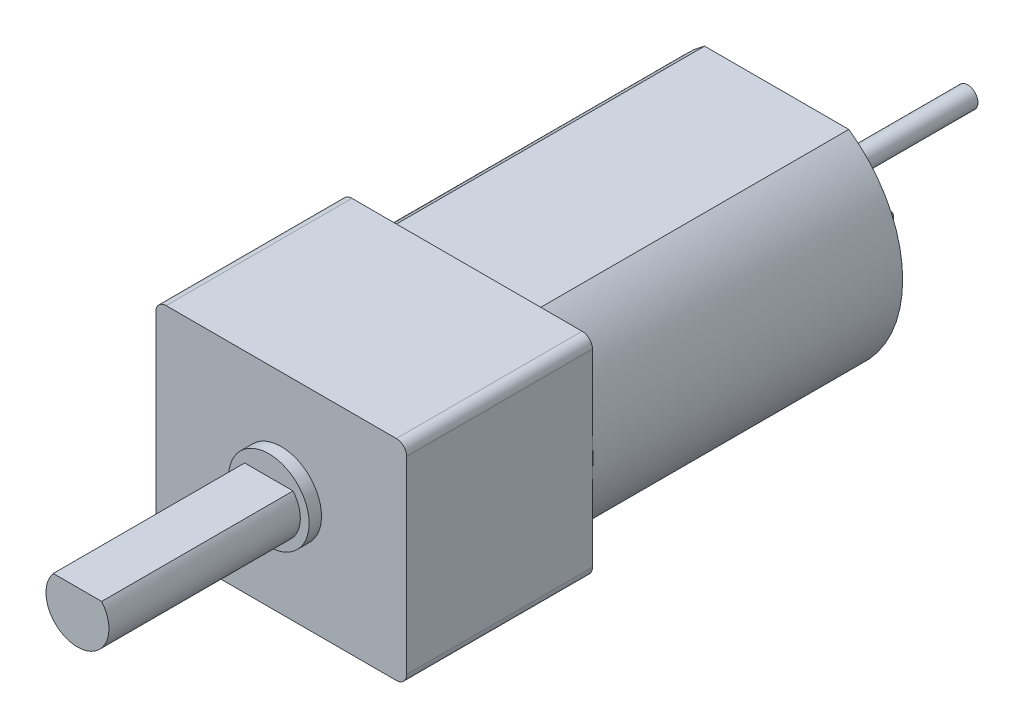
from build123d import *

# Parameters (mm, degrees)
SKETCH1_W            = 12.15
SKETCH1_H            = 10.15
EXTRUDE2_DEPTH       = 9
SKETCH11_R           = 1.95
EXTRUDE5_DEPTH       = 0.6
EXTRUDE6_DEPTH       = 9.27
EXTRUDE7_DEPTH       = 15
SKETCH14_R           = 2.5
EXTRUDE8_DEPTH       = 1.5
SKETCH16_W           = 0.3
SKETCH16_H           = 1.5
EXTRUDE10_DEPTH      = 2
FILLET1_R            = 0.3
FILLET1_OF_MIRROR1_R = 0.3
FILLET2_R            = 0.5
FILLET3_R            = 0.3
SKETCH17_R           = 0.5
EXTRUDE11_DEPTH      = 7.75


with BuildPart() as part:
    # Sketch1 → Extrude2 (new body)
    with BuildSketch(Plane.XY):
        Rectangle(SKETCH1_W, SKETCH1_H)
    extrude(amount=-EXTRUDE2_DEPTH)

    # Sketch11 → Extrude5 (add)
    with BuildSketch(Plane.XY):
        Circle(SKETCH11_R)
    extrude(amount=EXTRUDE5_DEPTH)

    # Sketch12 → Extrude6 (add)
    with BuildSketch(Plane.XY.offset(0.6)):
        with BuildLine():
            Line((-1.17260394, 0.975), (1.17260394, 0.975))
            ThreePointArc((1.17260394, 0.975), (0, -1.525), (-1.17260394, 0.975))
        make_face()
    extrude(amount=EXTRUDE6_DEPTH)

    # Sketch13 → Extrude7 (add)
    with BuildSketch(Plane(origin=(0, 0, -9), x_dir=(-1, 0, 0), z_dir=(0, 0, -1))):
        with BuildLine():
            Line((-3.494281042, 5), (3.494281042, 5))
            ThreePointArc((3.494281042, 5), (6.1, 0), (3.494281042, -5))
            Line((3.494281042, -5), (-3.494281042, -5))
            ThreePointArc((-3.494281042, -5), (-6.1, 0), (-3.494281042, 5))
        make_face()
    extrude(amount=EXTRUDE7_DEPTH)

    # Sketch14 → Extrude8 (add)
    with BuildSketch(Plane(origin=(0, 0, -24), x_dir=(-1, 0, 0), z_dir=(0, 0, -1))):
        Circle(SKETCH14_R)
    extrude(amount=EXTRUDE8_DEPTH)

    # Sketch16 → Extrude10 (add)
    with BuildSketch(Plane(origin=(0, 0, -24), x_dir=(-1, 0, 0), z_dir=(0, 0, -1))):
        with Locations((3.5, 0)):
            Rectangle(SKETCH16_W, SKETCH16_H)
    extrude10 = extrude(amount=EXTRUDE10_DEPTH)

    # Fillet1
    fillet1_edges = [part.edges().sort_by_distance(p)[0] for p in [
        (-3.5, -0.75, -26),
        (-3.5, 0.75, -26),
    ]]
    fillet(fillet1_edges, radius=FILLET1_R)

    # Mirror1: Extrude10 across plane
    add(extrude10.mirror(Plane(origin=(0, 0, 0), x_dir=(0, 0, 1), z_dir=(1, 0, 0))))

    # Fillet1 of Mirror1
    fillet1_of_mirror1_edges = [part.edges().sort_by_distance(p)[0] for p in [
        (3.5, -0.75, -26),
        (3.5, 0.75, -26),
    ]]
    fillet(fillet1_of_mirror1_edges, radius=FILLET1_OF_MIRROR1_R)

    # Fillet2
    fillet2_edges = [part.edges().sort_by_distance(p)[0] for p in [
        (-6.075, 5.075, -4.5),
        (6.075, 5.075, -4.5),
        (6.075, -5.075, -4.5),
        (-6.075, -5.075, -4.5),
    ]]
    fillet(fillet2_edges, radius=FILLET2_R)

    # Fillet3
    fillet3_edges = [part.edges().sort_by_distance(p)[0] for p in [
        (2.5, 0, -25.5),
    ]]
    fillet(fillet3_edges, radius=FILLET3_R)

    # Sketch17 → Extrude11 (add)
    with BuildSketch(Plane(origin=(0, 0, -25.5), x_dir=(-1, 0, 0), z_dir=(0, 0, -1))):
        Circle(SKETCH17_R)
    extrude(amount=EXTRUDE11_DEPTH)


solid = part.part
